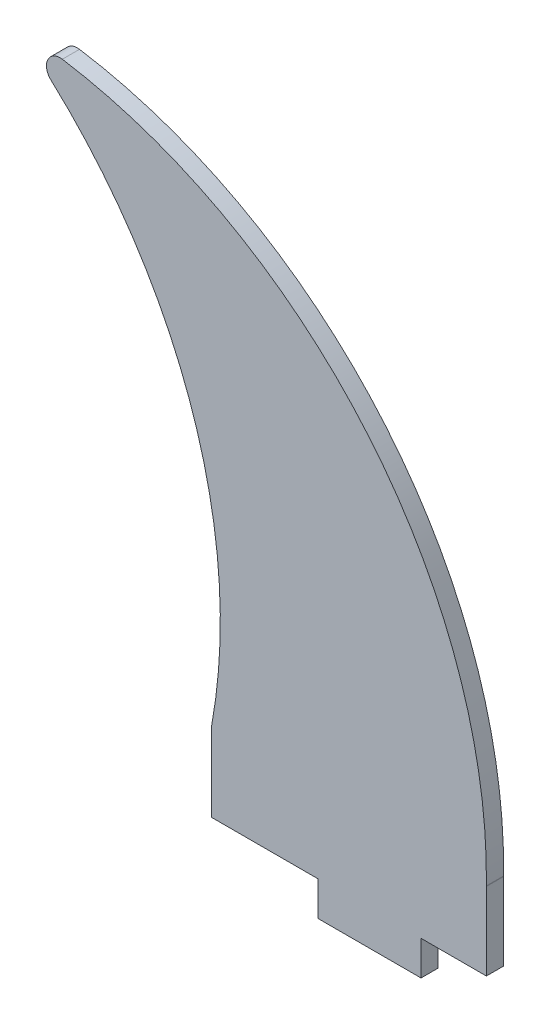
from build123d import *

# Parameters (mm, degrees)
SKETCH1_W           = 19.05
SKETCH1_H           = 6.35
BOSS_EXTRUDE2_DEPTH = 3.175
FILLET2_R           = 6.35
FILLET3_R           = 2.54


with BuildPart() as part:
    # Sketch1 → Boss-Extrude2 (new body)
    with BuildSketch(Plane.XY):
        with BuildLine():
            ThreePointArc((-36.016198934, 108.483524357), (26.192200246, 78.770561743), (50.822825228, 14.380520674))
            Line((50.822825228, 14.380520674), (0, 14.380520674))
            ThreePointArc((0, 14.380520674), (-4.688817641, 66.529733376), (-36.016198934, 108.483524357))
        make_face()
        Polygon((0, 0), (19.701608207, 0), (38.751608207, 0), (50.822825228, 0), (50.822825228, 14.380520674), (0, 14.380520674), align=None)
        with Locations((29.226608207, -3.175)):
            Rectangle(SKETCH1_W, SKETCH1_H)
    extrude(amount=BOSS_EXTRUDE2_DEPTH)

    # Fillet2
    fillet2_edges = [part.edges().sort_by_distance(p)[0] for p in [
        (50.822825228, 14.380520674, 1.5875),
        (0, 14.380520674, 1.5875),
    ]]
    fillet(fillet2_edges, radius=FILLET2_R)

    # Fillet3
    fillet3_edges = [part.edges().sort_by_distance(p)[0] for p in [
        (-36.016198934, 108.483524357, 1.5875),
    ]]
    fillet(fillet3_edges, radius=FILLET3_R)


solid = part.part
